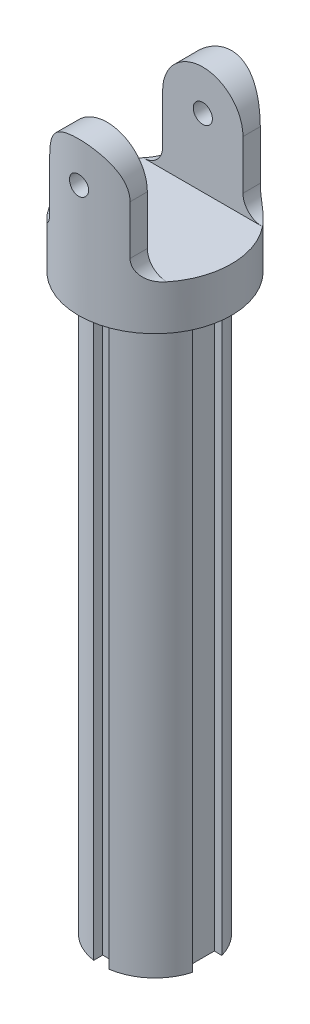
from build123d import *

# Parameters (mm, degrees)
SKETCH1_R               = 6
BOSS_EXTRUDE1_DEPTH     = 12
CUT_EXTRUDE1_DEPTH      = 15.696938457
CUT_EXTRUDE1_DEPTH_BACK = 15.696938457
SKETCH2_W               = 7.5
SKETCH2_H               = 8.5
CUT_EXTRUDE2_DEPTH      = 15.696938457
CUT_EXTRUDE2_DEPTH_BACK = 15.696938457
SKETCH3_R               = 0.75
BOSS_EXTRUDE2_DEPTH     = 45


with BuildPart() as part:
    # Sketch1 → Boss-Extrude1 (new body)
    with BuildSketch(Plane(origin=(0, 0, 0), x_dir=(1, 0, 0), z_dir=(0, 1, 0))):
        with Locations(Location((0, 0, 0), (0, 0, 270))):
            Circle(SKETCH1_R)
    extrude(amount=BOSS_EXTRUDE1_DEPTH)

    # Sketch2 → Cut-Extrude1 (cut, two sides: drawn at the far end of the back side and taken through both)
    with BuildSketch(Plane(origin=(0, 0, 0), x_dir=(0, 0, -1), z_dir=(1, 0, 0)).offset(-CUT_EXTRUDE1_DEPTH_BACK)):
        with Locations((0, 7.75)):
            Rectangle(SKETCH2_W, SKETCH2_H)
    extrude(amount=CUT_EXTRUDE1_DEPTH + CUT_EXTRUDE1_DEPTH_BACK, mode=Mode.SUBTRACT)

    # Sketch3 → Cut-Extrude2 (cut, two sides: drawn at the far end of the back side and taken through both)
    with BuildSketch(Plane.XY.offset(-CUT_EXTRUDE2_DEPTH_BACK)):
        with BuildLine():
            Line((-3.15, 5), (-3.15, 8.85))
            ThreePointArc((-3.15, 8.85), (-2.227386361, 11.077386361), (0, 12))
            Line((0, 12), (-4.683748499, 12))
            Line((-4.683748499, 12), (-4.683748499, 3.5))
            Line((-4.683748499, 3.5), (-4.65, 3.5))
            ThreePointArc((-4.65, 3.5), (-3.589339828, 3.939339828), (-3.15, 5))
        make_face()
        with BuildLine():
            Line((4.683748499, 12), (0, 12))
            ThreePointArc((0, 12), (2.227386361, 11.077386361), (3.15, 8.85))
            Line((3.15, 8.85), (3.15, 5))
            ThreePointArc((3.15, 5), (3.589339828, 3.939339828), (4.65, 3.5))
            Line((4.65, 3.5), (4.683748499, 3.5))
            Line((4.683748499, 3.5), (4.683748499, 12))
        make_face()
        with Locations((0, 8.85)):
            Circle(SKETCH3_R)
    extrude(amount=CUT_EXTRUDE2_DEPTH + CUT_EXTRUDE2_DEPTH_BACK, mode=Mode.SUBTRACT)

    # Sketch4 → Boss-Extrude2 (add)
    with BuildSketch(Plane.XZ):
        with BuildLine():
            Line((-0.6, 3.5), (-0.6, 4.207433897))
            ThreePointArc((-0.6, 4.207433897), (-2.799894973, 3.19735643), (-4.091454509, 1.15))
            Line((-4.091454509, 1.15), (-3.5, 1.15))
            Line((-3.5, 1.15), (-3.5, -1.15))
            Line((-3.5, -1.15), (-4.091454509, -1.15))
            ThreePointArc((-4.091454509, -1.15), (-2.799894973, -3.19735643), (-0.6, -4.207433897))
            Line((-0.6, -4.207433897), (-0.6, -3.5))
            Line((-0.6, -3.5), (0.6, -3.5))
            Line((0.6, -3.5), (0.6, -4.207433897))
            ThreePointArc((0.6, -4.207433897), (2.799894973, -3.19735643), (4.091454509, -1.15))
            Line((4.091454509, -1.15), (3.5, -1.15))
            Line((3.5, -1.15), (3.5, 1.15))
            Line((3.5, 1.15), (4.091454509, 1.15))
            ThreePointArc((4.091454509, 1.15), (2.799894973, 3.19735643), (0.6, 4.207433897))
            Line((0.6, 4.207433897), (0.6, 3.5))
            Line((0.6, 3.5), (-0.6, 3.5))
        make_face()
    extrude(amount=BOSS_EXTRUDE2_DEPTH)


solid = part.part
